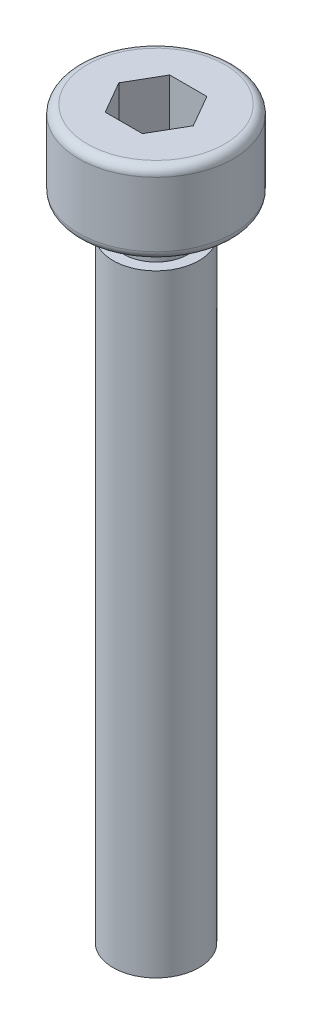
from build123d import *

# Parameters (mm, degrees)
CUT_EXTRUDE_1_DEPTH = 2.8


with BuildPart() as part:
    # 草图1 → 旋转1 (revolve)
    with BuildSketch(Plane.XY, mode=Mode.PRIVATE) as revolve_1_sk:
        with BuildLine():
            Line((0, 33.8), (-3.2, 33.8))
            ThreePointArc((-3.2, 33.8), (-3.482842712, 33.682842712), (-3.6, 33.4))
            Line((-3.6, 33.4), (-3.6, 30.4))
            ThreePointArc((-3.6, 30.4), (-3.482842712, 30.117157288), (-3.2, 30))
            Line((-3.2, 30), (-1.5, 30))
            Line((-1.5, 30), (-1.5, 28.5))
            Line((-1.5, 28.5), (-2, 28.5))
            Line((-2, 28.5), (-2, 0))
            Line((-2, 0), (0, 0))
            Line((0, 0), (0, 33.8))
        make_face()
    revolve(revolve_1_sk.sketch.rotate(Axis((0, 0, 0), (0, 1, 0)), 270), axis=Axis((0, 0, 0), (0, 1, 0)))

    # 草图2 → 切除-拉伸1 (cut)
    with BuildSketch(Plane(origin=(0, 33.8, 0), x_dir=(1, 0, 0), z_dir=(0, 1, 0))):
        Polygon((-0.866025404, 1.5), (-1.732050808, 0), (-0.866025404, -1.5), (0.866025404, -1.5), (1.732050808, 0), (0.866025404, 1.5), align=None)
    extrude(amount=-CUT_EXTRUDE_1_DEPTH, mode=Mode.SUBTRACT)


solid = part.part
